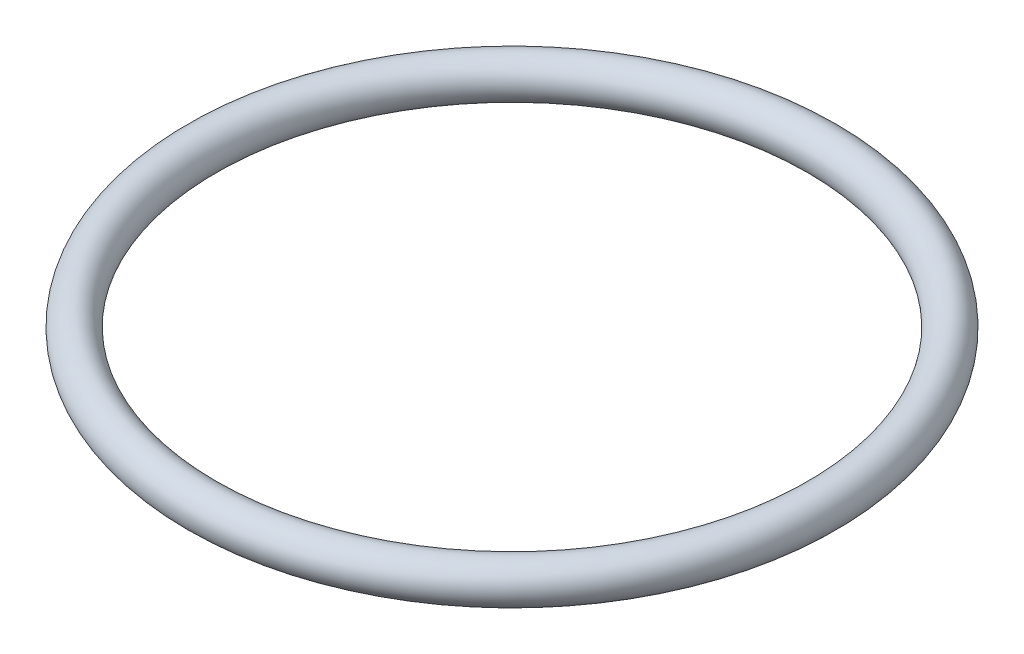
from build123d import *

# Parameters (mm, degrees)
SKETCH1_R = 1.25


with BuildPart() as part:
    # Sketch1 → Revolve1 (revolve)
    with BuildSketch(Plane.XY, mode=Mode.PRIVATE) as revolve1_sk:
        with Locations((-19.45, 0)):
            Circle(SKETCH1_R)
    revolve(revolve1_sk.sketch.rotate(Axis((0, 0, 0), (0, 1, 0)), 270), axis=Axis((0, 0, 0), (0, 1, 0)))


solid = part.part
